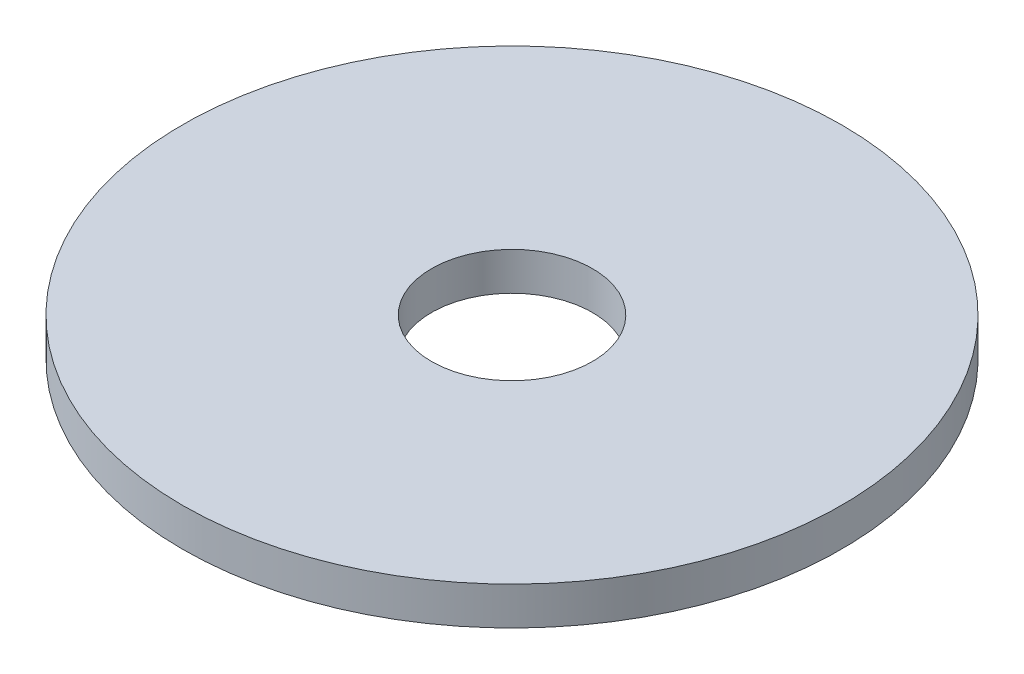
from build123d import *

# Parameters (mm, degrees)
SKETCH1_R           = 26
SKETCH1_R_2         = 6.35
BOSS_EXTRUDE1_DEPTH = 3


with BuildPart() as part:
    # Sketch1 → Boss-Extrude1 (new body)
    with BuildSketch(Plane(origin=(0, 0, 0), x_dir=(1, 0, 0), z_dir=(0, 1, 0))):
        with Locations(Location((0, 0, 0), (0, 0, 270))):
            Circle(SKETCH1_R)
        with Locations(Location((0, 0, 0), (0, 0, 270))):
            Circle(SKETCH1_R_2, mode=Mode.SUBTRACT)
    extrude(amount=BOSS_EXTRUDE1_DEPTH)


solid = part.part
